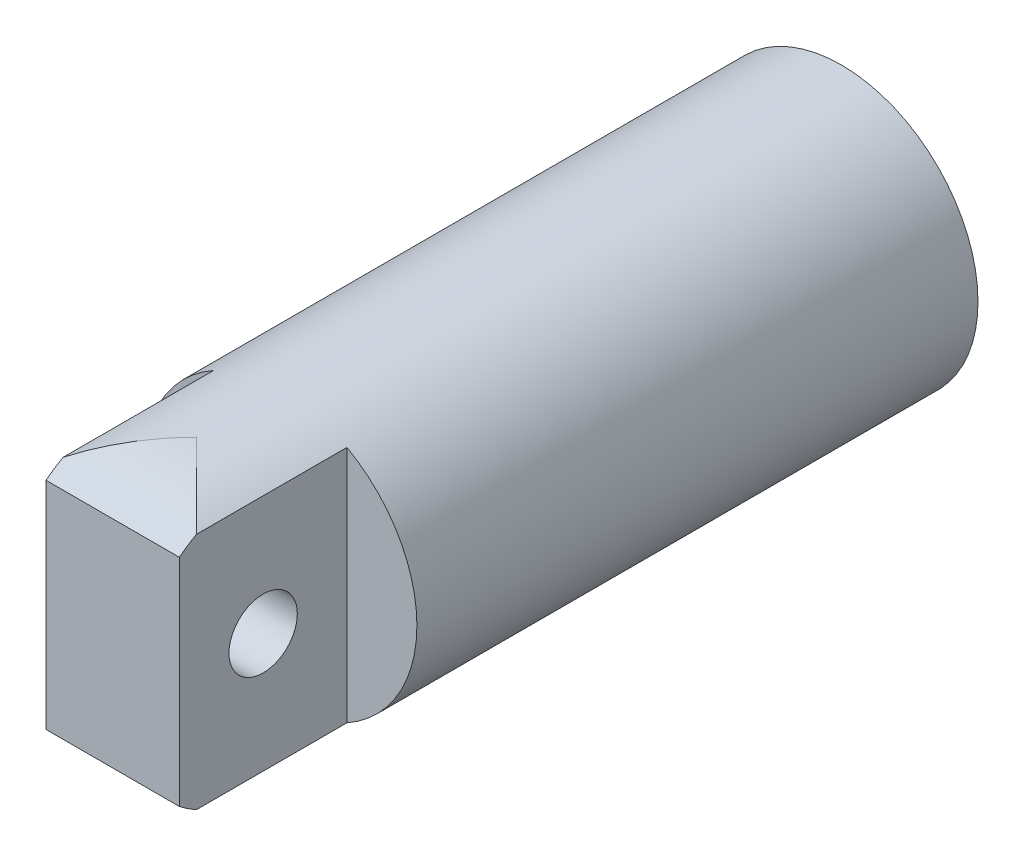
from build123d import *

# Parameters (mm, degrees)
SKETCH1_R                       = 4.7625
BOSS_EXTRUDE1_DEPTH             = 25.4
SKETCH2_OUTSIDE_W               = 17.274
SKETCH2_OUTSIDE_H               = 17.274
SKETCH2_OUTSIDE_W_2             = 4.6482
SKETCH2_OUTSIDE_H_2             = 9.525
CUT_EXTRUDE1_DEPTH              = 5.842
F_3_32_0_09375_DIAMETER_HOLE1_D = 2.38125
CUT_EXTRUDE2_DEPTH              = 27.796665946
TAP_DRILL_FOR_10_24_TAP1_D      = 3.7973
TAP_DRILL_FOR_10_24_TAP1_DEPTH  = 15.875
TAP_DRILL_FOR_10_24_TAP1_TIP    = 1.140824014


with BuildPart() as part:
    # Sketch1 → Boss-Extrude1 (new body)
    with BuildSketch(Plane.XY):
        Circle(SKETCH1_R)
    extrude(amount=BOSS_EXTRUDE1_DEPTH)

    # Sketch2 outside → Cut-Extrude1 (cut)
    with BuildSketch(Plane.XY.offset(25.4)):
        Rectangle(SKETCH2_OUTSIDE_W, SKETCH2_OUTSIDE_H)
        Rectangle(SKETCH2_OUTSIDE_W_2, SKETCH2_OUTSIDE_H_2, mode=Mode.SUBTRACT)
    extrude(amount=-CUT_EXTRUDE1_DEPTH, mode=Mode.SUBTRACT)

    # 3/32 (0.09375) Diameter Hole1 (through all)
    with Locations(Plane.ZY.offset(2.3241)):
        with Locations((22.479, 0)):
            Hole(F_3_32_0_09375_DIAMETER_HOLE1_D / 2)

    # Sketch5 → Cut-Extrude2 (cut, through all)
    with BuildSketch(Plane.ZY.offset(2.3241)):
        with BuildLine():
            Line((22.479, 4.7625), (32.004, 4.7625))
            Line((32.004, 4.7625), (32.004, -4.7625))
            Line((32.004, -4.7625), (22.479, -4.7625))
            ThreePointArc((22.479, -4.7625), (27.2415, 0), (22.479, 4.7625))
        make_face()
    extrude(amount=-CUT_EXTRUDE2_DEPTH, mode=Mode.SUBTRACT)

    # Tap Drill for #10-24 Tap1
    with Locations(Plane(origin=(0, 0, 0), x_dir=(-1, 0, 0), z_dir=(0, 0, -1))):
        with Locations((0, 0)):
            Hole(TAP_DRILL_FOR_10_24_TAP1_D / 2, depth=TAP_DRILL_FOR_10_24_TAP1_DEPTH)
            with Locations((0, 0, -(TAP_DRILL_FOR_10_24_TAP1_DEPTH + TAP_DRILL_FOR_10_24_TAP1_TIP / 2))):  # 118° drill point
                Cone(0, TAP_DRILL_FOR_10_24_TAP1_D / 2, TAP_DRILL_FOR_10_24_TAP1_TIP, mode=Mode.SUBTRACT)


solid = part.part
